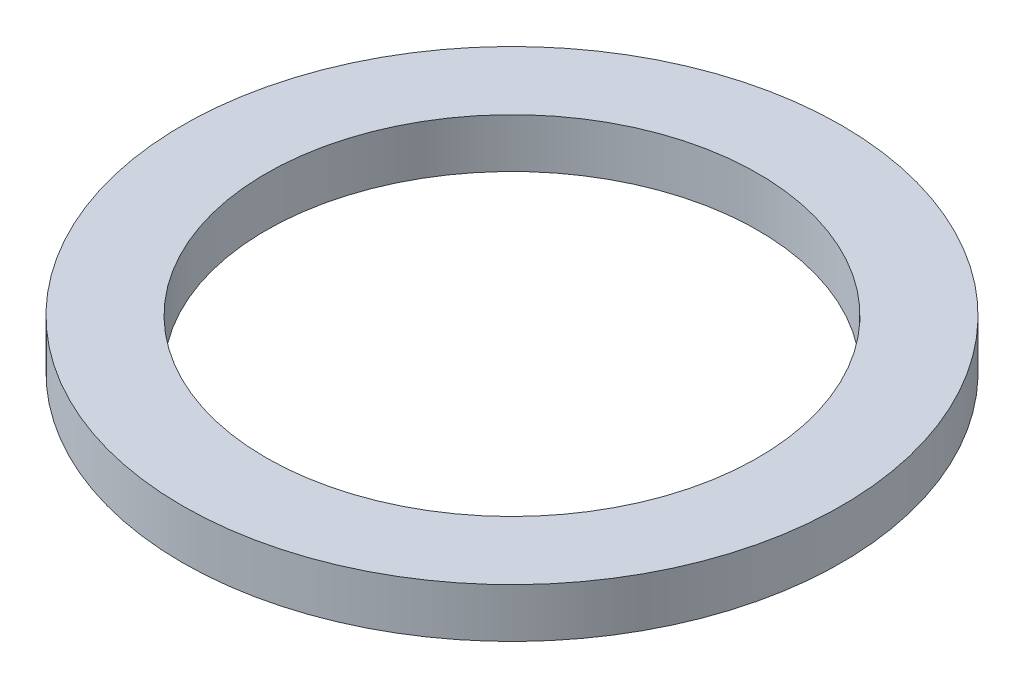
from build123d import *

# Parameters (mm, degrees)
SKETCH1_R           = 4.7625
BOSS_EXTRUDE1_DEPTH = 0.7112
SKETCH5_R           = 3.556
CUT_EXTRUDE1_DEPTH  = 7.772637443


with BuildPart() as part:
    # Sketch1 → Boss-Extrude1 (new body)
    with BuildSketch(Plane(origin=(0, 0, 0), x_dir=(1, 0, 0), z_dir=(0, 1, 0))):
        with Locations(Location((0, 0, 0), (0, 0, 270))):
            Circle(SKETCH1_R)
    extrude(amount=BOSS_EXTRUDE1_DEPTH)

    # Sketch5 → Cut-Extrude1 (cut, through all)
    with BuildSketch(Plane(origin=(0, 0.7112, 0), x_dir=(-1, 0, 0), z_dir=(0, 1, 0))):
        with Locations(Location((0, 0, 0), (0, 0, 90))):
            Circle(SKETCH5_R)
    extrude(amount=-CUT_EXTRUDE1_DEPTH, mode=Mode.SUBTRACT)


solid = part.part
